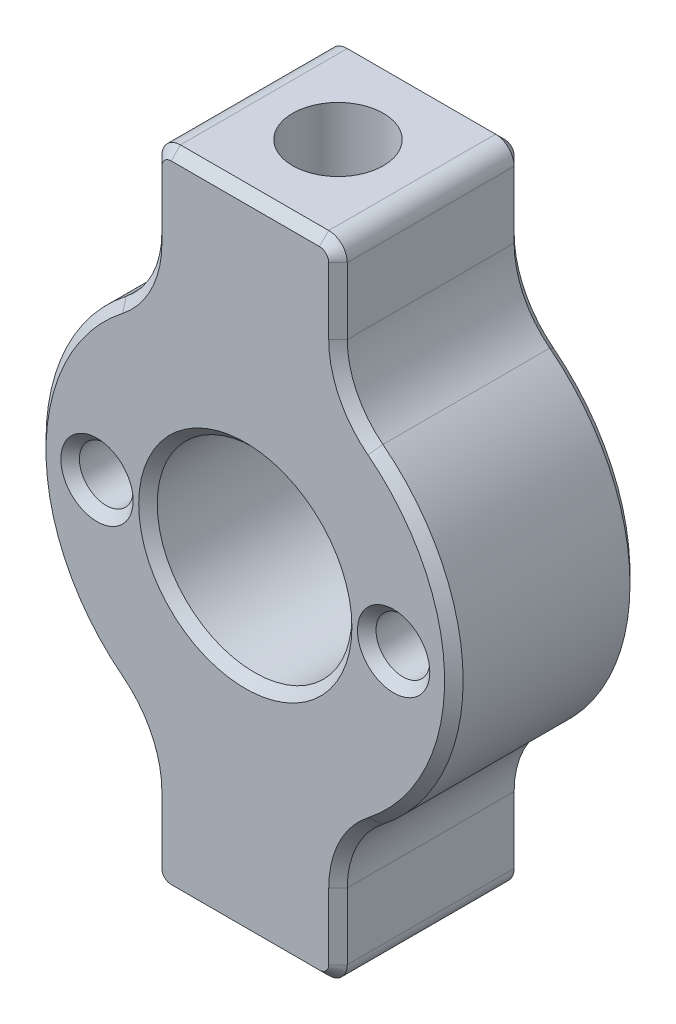
from build123d import *

# Parameters (mm, degrees)
SKIZZE1_R                       = 11.25
SKIZZE1_R_2                     = 5.25
AUFSATZ_LINEAR_AUSTRAGEN1_DEPTH = 10
AUFSATZ_LINEAR_START            = 6
SKIZZE2_W                       = 10
SKIZZE2_H                       = 10
AUFSATZ_LINEAR_AUSTRAGEN2_DEPTH = 11.4
SKIZZE3_R                       = 2.45
SCHNITT_LINEAR_AUSTRAGEN1_DEPTH = 10
SKIZZE4_R                       = 1.45
SCHNITT_LINEAR_AUSTRAGEN2_DEPTH = 8
VERRUNDUNG2_R                   = 5
VERRUNDUNG1_R                   = 1
FASE1_SIZE                      = 0.5


with BuildPart() as part:
    # Skizze1 → Aufsatz-Linear austragen1 (new body)
    with BuildSketch(Plane.XY):
        Circle(SKIZZE1_R)
        Circle(SKIZZE1_R_2, mode=Mode.SUBTRACT)
    extrude(amount=AUFSATZ_LINEAR_AUSTRAGEN1_DEPTH)

    # Skizze2 → Aufsatz-Linear austragen2 (add)
    with BuildSketch(Plane(origin=(0, 0, 0), x_dir=(1, 0, 0), z_dir=(0, 1, 0)).offset(AUFSATZ_LINEAR_START)):
        with Locations((0, -5)):
            Rectangle(SKIZZE2_W, SKIZZE2_H)
    aufsatz_linear_austragen2 = extrude(amount=AUFSATZ_LINEAR_AUSTRAGEN2_DEPTH)

    # Skizze3 → Schnitt-Linear austragen1 (cut)
    with BuildSketch(Plane(origin=(0, 17.4, 0), x_dir=(1, 0, 0), z_dir=(0, 1, 0))):
        with Locations(Location((0, -5, 0), (0, 0, 270))):
            Circle(SKIZZE3_R)
    schnitt_linear_austragen1 = extrude(amount=-SCHNITT_LINEAR_AUSTRAGEN1_DEPTH, mode=Mode.SUBTRACT)

    # Spiegeln1: Aufsatz-Linear austragen2, Schnitt-Linear austragen1 across plane
    add(aufsatz_linear_austragen2.mirror(Plane.ZX))
    add(schnitt_linear_austragen1.mirror(Plane.ZX), mode=Mode.SUBTRACT)

    # Skizze4 → Schnitt-Linear austragen2 (cut)
    with BuildSketch(Plane.XY.offset(10)):
        with Locations((8, 0)):
            Circle(SKIZZE4_R)
        with Locations(Location((-8, 0, 0), (0, 0, 180))):
            Circle(SKIZZE4_R)
    extrude(amount=-SCHNITT_LINEAR_AUSTRAGEN2_DEPTH, mode=Mode.SUBTRACT)

    # Verrundung2
    verrundung2_edges = [part.edges().sort_by_distance(p)[0] for p in [
        (-5, 10.077822185, 5),
        (5, 10.077822185, 5),
        (5, -10.077822185, 5),
        (-5, -10.077822185, 5),
    ]]
    fillet(verrundung2_edges, radius=VERRUNDUNG2_R)

    # Verrundung1
    verrundung1_edges = [part.edges().sort_by_distance(p)[0] for p in [
        (5, 17.4, 5),
        (-5, 17.4, 5),
        (5, -17.4, 5),
        (-5, -17.4, 5),
    ]]
    fillet(verrundung1_edges, radius=VERRUNDUNG1_R)

    # Fase1
    fase1_edges = [part.edges().sort_by_distance(p)[0] for p in [
        (-5, 14.604344229, 10),
        (-5, -14.604344229, 10),
        (0, -17.4, 10),
        (5, -14.604344229, 10),
        (5, 14.604344229, 10),
        (-4.707106781, -17.107106781, 10),
        (4.707106781, -17.107106781, 10),
        (4.707106781, 17.107106781, 10),
        (-4.707106781, 17.107106781, 10),
        (-5, 14.604344229, 0),
        (5, -14.604344229, 0),
        (0, -17.4, 0),
        (-5, -14.604344229, 0),
        (5, 14.604344229, 0),
        (-4.707106781, -17.107106781, 0),
        (4.707106781, -17.107106781, 0),
        (4.707106781, 17.107106781, 0),
        (-4.707106781, 17.107106781, 0),
        (-5.25, 0, 0),
        (-5.25, 0, 10),
        (6.55, 0, 10),
        (-6.55, 0, 10),
        (-11.25, 0, 0),
        (-11.25, 0, 10),
        (11.25, 0, 10),
        (11.25, 0, 0),
        (-5.506414829, -10.616043409, 10),
        (-5.506414829, -10.616043409, 0),
        (-5.506414829, 10.616043409, 10),
        (-5.506414829, 10.616043409, 0),
        (5.506414829, 10.616043409, 0),
        (5.506414829, 10.616043409, 10),
        (5.506414829, -10.616043409, 0),
        (5.506414829, -10.616043409, 10),
        (0, 17.4, 0),
        (0, 17.4, 10),
    ]]
    chamfer(fase1_edges, length=FASE1_SIZE)


solid = part.part
